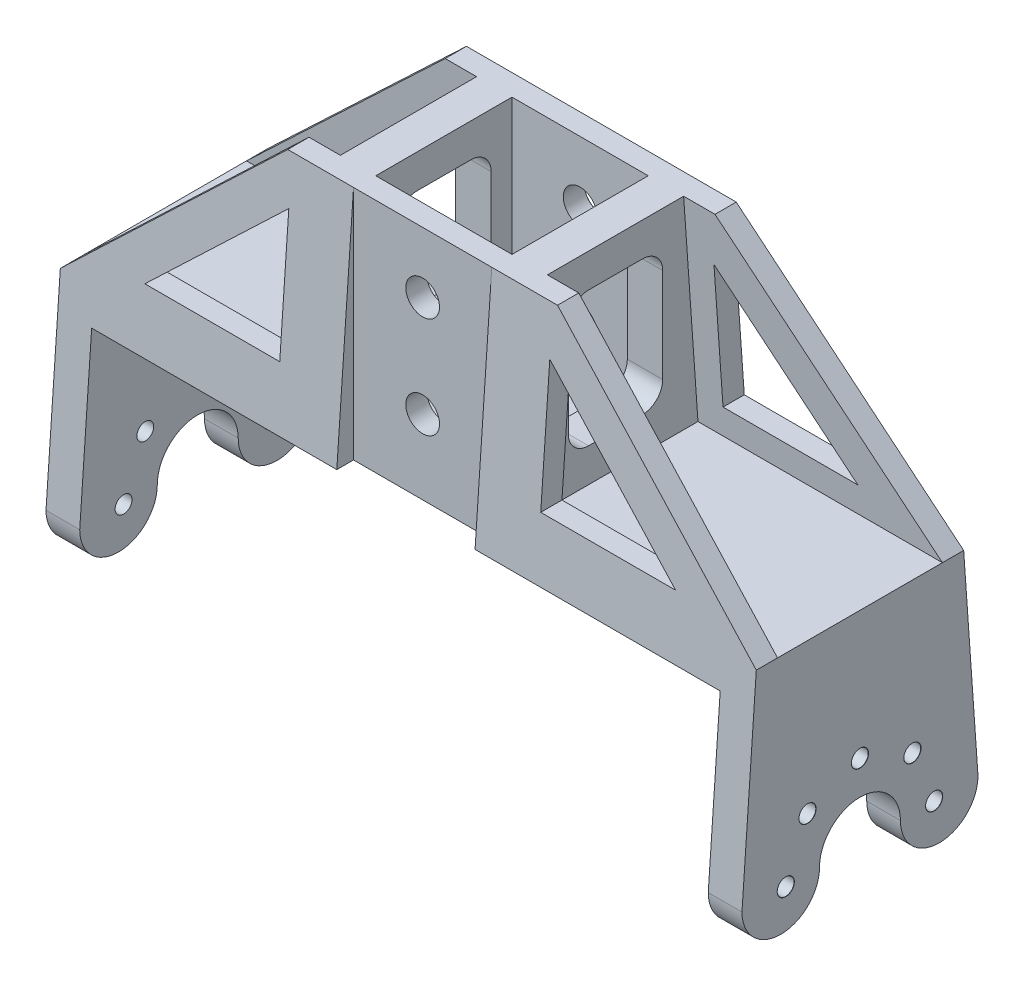
from build123d import *

# Parameters (mm, degrees)
EXTRUDE_1_DEPTH       = 35
SKETCH_6_R            = 6
CUT_EXTRUDE_2_DEPTH   = 103.2
SKETCH_7_R            = 5.75
EXTRUDE_3_DEPTH       = 103.2
CUT_EXTRUDE_3_REACH   = 88.478
F_2_5MM_2_D           = 2.5
F_2_5MM_2_CSINK_D     = 2.55
F_2_5MM_2_CSINK_ANGLE = 90
SKETCH_16_W           = 20.2
SKETCH_16_H           = 20.2
CUT_EXTRUDE_5_DEPTH   = 30
SKETCH_15_W           = 20.5
SKETCH_15_H           = 35
CUT_EXTRUDE_6_DEPTH   = 4.25
SKETCH_17_W           = 20.5
SKETCH_17_H           = 35
CUT_EXTRUDE_7_DEPTH   = 4.25
F_5_0MM_1_D           = 5
F_5_0MM_1_CSINK_D     = 5.05
F_5_0MM_1_CSINK_ANGLE = 90
CUT_EXTRUDE_8_REACH   = 126.363
CUT_EXTRUDE_9_DEPTH   = 36.25
CUT_EXTRUDE_10_DEPTH  = 36.25
CUT_EXTRUDE_11_REACH  = 98.427
CUT_EXTRUDE_12_DEPTH  = 87.477815158


with BuildPart() as part:
    # 草图1 → 凸台-拉伸1 (new body)
    with BuildSketch(Plane.XY):
        Polygon((51.6, -0.076277531), (51.6, 29.923722469), (20, 59.923722469), (-20, 59.923722469), (-51.6, 29.923722469), (-51.6, -0.076277531), align=None)
    extrude(amount=EXTRUDE_1_DEPTH)

    # 草图6 → 切除-拉伸2 (cut)
    with BuildSketch(Plane.ZY.offset(51.6)):
        with Locations((17.5, -0.076277531)):
            Circle(SKETCH_6_R)
    extrude(amount=-CUT_EXTRUDE_2_DEPTH, mode=Mode.SUBTRACT)

    # 草图7 → 凸台-拉伸3 (add)
    with BuildSketch(Plane.ZY.offset(51.6)):
        with Locations((5.75, -0.076277531)):
            Circle(SKETCH_7_R)
        with Locations((29.25, -0.076277531)):
            Circle(SKETCH_7_R)
    extrude(amount=-EXTRUDE_3_DEPTH)

    # 切除-拉伸3: up to this face of the body (flat: up to its plane)
    cut_extrude_3_end = Plane(part.part.faces().sort_by_distance((0, 26.308161829, 0))[0])
    # 草图8 → 切除-拉伸3 (cut, up to the picked face)
    with BuildSketch(Plane.XY.offset(35), mode=Mode.PRIVATE) as cut_extrude_3_sk1:
        Polygon((-46.6, -0.076277531), (-46.6, 24.923722469), (46.6, 24.923722469), (46.6, -0.076277531), (46.6, -12.111349377), (-46.6, -12.111349377), align=None)
    cut_extrude_3_tool1 = split(extrude(cut_extrude_3_sk1.sketch, amount=-CUT_EXTRUDE_3_REACH, mode=Mode.PRIVATE), bisect_by=cut_extrude_3_end, keep=Keep.BOTH, mode=Mode.PRIVATE)
    add(cut_extrude_3_tool1.solids().sort_by(Axis((0, 6.406187, 35), (0, 0, -1)))[0], mode=Mode.SUBTRACT)

    # Ø2.5mm 暗销孔2 (through all)
    with Locations(Plane(origin=(51.6, 0, 0), x_dir=(0, 0, -1), z_dir=(1, 0, 0))):
        with Locations((-28.5, -0.076277531), (-25.278174593, 7.701897062), (-17.5, 10.923722469), (-9.721825407, 7.701897062), (-6.5, -0.076277531)):
            CounterSinkHole(F_2_5MM_2_D / 2, F_2_5MM_2_CSINK_D / 2, counter_sink_angle=F_2_5MM_2_CSINK_ANGLE)

    # 草图16 → 切除-拉伸5 (cut)
    with BuildSketch(Plane(origin=(0, 59.923722469, 0), x_dir=(1, 0, 0), z_dir=(0, 1, 0))):
        with Locations((0, -17.5)):
            Rectangle(SKETCH_16_W, SKETCH_16_H)
    extrude(amount=-CUT_EXTRUDE_5_DEPTH, mode=Mode.SUBTRACT)

    # 草图15 → 切除-拉伸6 (cut)
    with BuildSketch(Plane.XY.offset(35)):
        with Locations((0, 42.423722469)):
            Rectangle(SKETCH_15_W, SKETCH_15_H)
    extrude(amount=-CUT_EXTRUDE_6_DEPTH, mode=Mode.SUBTRACT)

    # 草图17 → 切除-拉伸7 (cut)
    with BuildSketch(Plane(origin=(0, 0, 0), x_dir=(-1, 0, 0), z_dir=(0, 0, -1))):
        with Locations((0, 42.423722469)):
            Rectangle(SKETCH_17_W, SKETCH_17_H)
    extrude(amount=-CUT_EXTRUDE_7_DEPTH, mode=Mode.SUBTRACT)

    # Ø5.0mm 暗销孔1 (through all)
    with Locations(Plane(origin=(0, 0, 4.25), x_dir=(-1, 0, 0), z_dir=(0, 0, -1))):
        with Locations((0, 50.923722469), (0, 35.923722469)):
            CounterSinkHole(F_5_0MM_1_D / 2, F_5_0MM_1_CSINK_D / 2, counter_sink_angle=F_5_0MM_1_CSINK_ANGLE)

    # 切除-拉伸8: up to this face of the body (flat: up to its plane)
    cut_extrude_8_end = Plane(part.part.faces().sort_by_distance((-51.6, 14.113222329, 17.5))[0])
    # 草图20 → 切除-拉伸8 (cut, up to the picked face)
    with BuildSketch(Plane(origin=(51.6, 0, 0), x_dir=(0, 0, -1), z_dir=(1, 0, 0)), mode=Mode.PRIVATE) as cut_extrude_8_sk1:
        Polygon((-30.75, 59.923722469), (-35, 59.923722469), (-35, -0.076277531), align=None)
    cut_extrude_8_tool1 = split(extrude(cut_extrude_8_sk1.sketch, amount=-CUT_EXTRUDE_8_REACH, mode=Mode.PRIVATE), bisect_by=cut_extrude_8_end, keep=Keep.BOTH, mode=Mode.PRIVATE)
    # 草图20 → 切除-拉伸8 (cut, up to the picked face)
    with BuildSketch(Plane(origin=(51.6, 0, 0), x_dir=(0, 0, -1), z_dir=(1, 0, 0)), mode=Mode.PRIVATE) as cut_extrude_8_sk2:
        Polygon((0, -0.076277531), (0, 59.923722469), (-4.25, 59.923722469), align=None)
    cut_extrude_8_tool2 = split(extrude(cut_extrude_8_sk2.sketch, amount=-CUT_EXTRUDE_8_REACH, mode=Mode.PRIVATE), bisect_by=cut_extrude_8_end, keep=Keep.BOTH, mode=Mode.PRIVATE)
    add(cut_extrude_8_tool1.solids().sort_by(Axis((51.6, 39.923722, 33.583333), (-1, 0, 0)))[0], mode=Mode.SUBTRACT)
    add(cut_extrude_8_tool2.solids().sort_by(Axis((51.6, 39.923722, 1.416667), (-1, 0, 0)))[0], mode=Mode.SUBTRACT)

    # 草图21 → 切除-拉伸9 (cut)
    with BuildSketch(Plane(origin=(51.6, 0, 0), x_dir=(0, 0, -1), z_dir=(1, 0, 0))):
        Polygon((-27.6, 59.923722469), (-29.725, 29.923722469), (-5.275, 29.923722469), (-7.4, 59.923722469), align=None)
    extrude(amount=-CUT_EXTRUDE_9_DEPTH, mode=Mode.SUBTRACT)

    # 草图22 → 切除-拉伸10 (cut)
    with BuildSketch(Plane.ZY.offset(51.6)):
        Polygon((29.725, 29.923722469), (27.6, 59.923722469), (7.4, 59.923722469), (5.275, 29.923722469), align=None)
    extrude(amount=-CUT_EXTRUDE_10_DEPTH, mode=Mode.SUBTRACT)

    # 切除-拉伸11: up to this face of the body (flat: up to its plane)
    cut_extrude_11_end = Plane(part.part.faces().sort_by_distance((15.35, 44.447798617, 17.5))[0])
    # 草图23 → 切除-拉伸11 (cut, up to the picked face)
    with BuildSketch(Plane.ZY.offset(15.35), mode=Mode.PRIVATE) as cut_extrude_11_sk1:
        with BuildLine():
            Line((13.5, 34.923722469), (21.5, 34.923722469))
            ThreePointArc((21.5, 34.923722469), (23.621320344, 35.802402126), (24.5, 37.923722469))
            Line((24.5, 37.923722469), (24.5, 51.923722469))
            ThreePointArc((24.5, 51.923722469), (23.621320344, 54.045042813), (21.5, 54.923722469))
            Line((21.5, 54.923722469), (13.5, 54.923722469))
            ThreePointArc((13.5, 54.923722469), (11.378679656, 54.045042813), (10.5, 51.923722469))
            Line((10.5, 51.923722469), (10.5, 37.923722469))
            ThreePointArc((10.5, 37.923722469), (11.378679656, 35.802402126), (13.5, 34.923722469))
        make_face()
    cut_extrude_11_tool1 = split(extrude(cut_extrude_11_sk1.sketch, amount=-CUT_EXTRUDE_11_REACH, mode=Mode.PRIVATE), bisect_by=cut_extrude_11_end, keep=Keep.BOTH, mode=Mode.PRIVATE)
    add(cut_extrude_11_tool1.solids().sort_by(Axis((-15.35, 44.923722, 17.5), (1, 0, 0)))[0], mode=Mode.SUBTRACT)

    # 草图25 → 切除-拉伸12 (cut, through all)
    with BuildSketch(Plane.XY):
        Polygon((39.35, 33.923722469), (19.35, 33.923722469), (19.35, 52.911064241), align=None)
        Polygon((-19.35, 52.911064241), (-39.35, 33.923722469), (-19.35, 33.923722469), align=None)
    extrude(amount=CUT_EXTRUDE_12_DEPTH, mode=Mode.SUBTRACT)


solid = part.part
